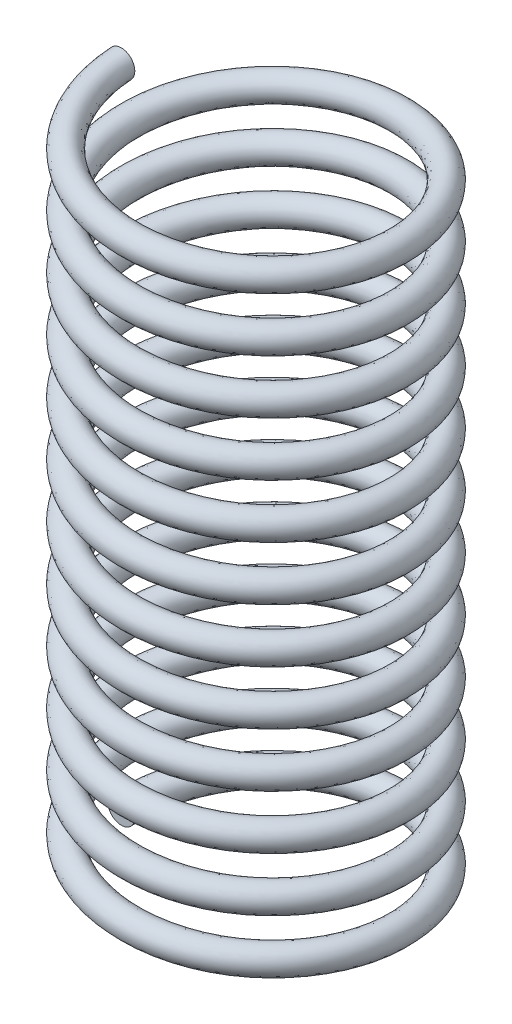
from build123d import *

# Parameters (mm, degrees)
SWEEP1_PITCH       = 1
SWEEP1_HEIGHT      = 12
SWEEP1_RADIUS      = 2.5
SWEEP1_START_ANGLE = -90
SKETCH6_R          = 0.25


with BuildPart() as part:
    # Sweep1: sweep along a helix
    with BuildLine() as sweep1_path:
        add(Helix(SWEEP1_PITCH, SWEEP1_HEIGHT, SWEEP1_RADIUS, center=(0, 0, 0), direction=(0, 1, 0), lefthand=True, mode=Mode.PRIVATE).rotate(Axis((0, 0, 0), (0, 1, 0)), SWEEP1_START_ANGLE))
    # Sketch6 → Sweep1 (sweep)
    with BuildSketch(Plane.XY):
        with Locations((-2.5, 12)):
            Circle(SKETCH6_R)
    sweep(path=sweep1_path.line, is_frenet=True)


solid = part.part
